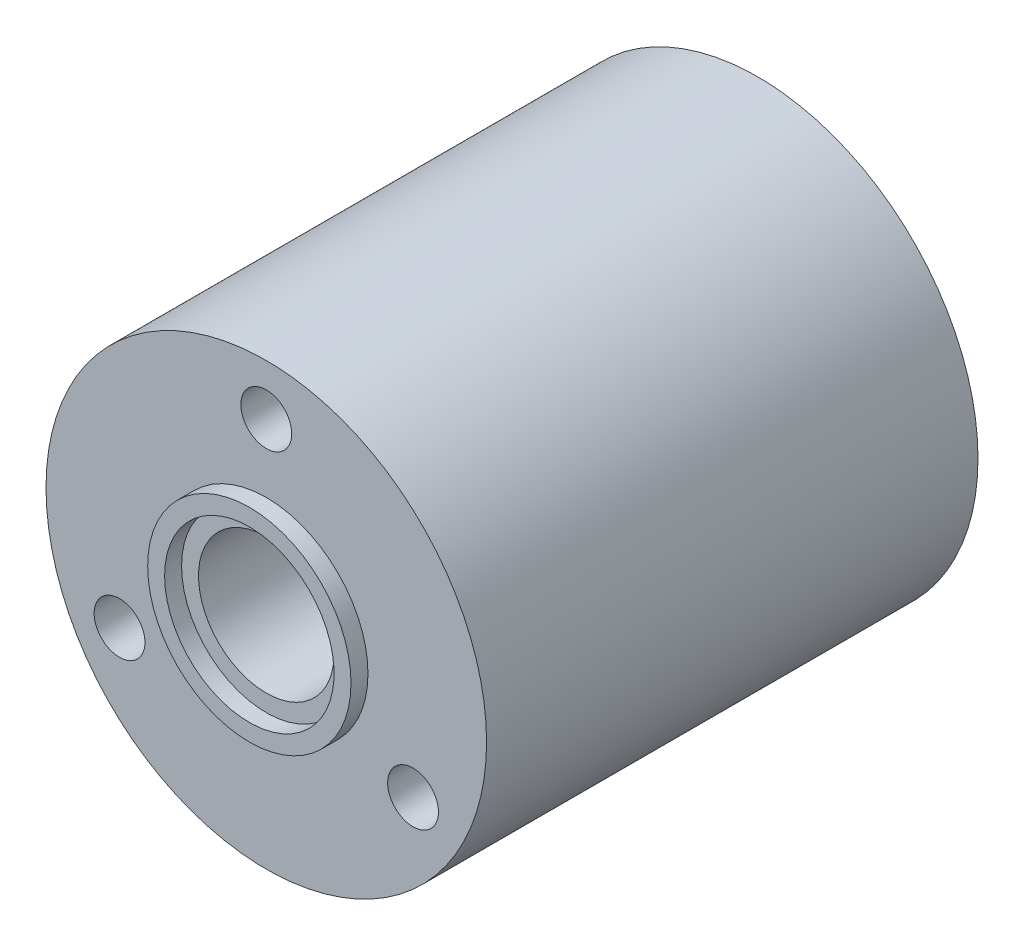
from build123d import *

# Parameters (mm, degrees)
SKETCH1_R           = 13
SKETCH1_R_2         = 5
BOSS_EXTRUDE1_DEPTH = 29
SKETCH2_R           = 6
SKETCH2_R_2         = 5
BOSS_EXTRUDE2_DEPTH = 1
SKETCH3_R           = 1.5
CUT_EXTRUDE1_DEPTH  = 36.185224172
SKETCH4_R           = 5
SKETCH4_R_2         = 4
BOSS_EXTRUDE3_DEPTH = 29


with BuildPart() as part:
    # Sketch1 → Boss-Extrude1 (new body)
    with BuildSketch(Plane.XY):
        with Locations(Location((0, 0, 0), (0, 0, 180))):
            Circle(SKETCH1_R)
        with Locations(Location((0, 0, 0), (0, 0, 180))):
            Circle(SKETCH1_R_2, mode=Mode.SUBTRACT)
    extrude(amount=BOSS_EXTRUDE1_DEPTH)

    # Sketch2 → Boss-Extrude2 (add)
    with BuildSketch(Plane.XY.offset(29)):
        Circle(SKETCH2_R)
        with Locations(Location((0, 0, 0), (0, 0, 180))):
            Circle(SKETCH2_R_2, mode=Mode.SUBTRACT)
    boss_extrude2 = extrude(amount=BOSS_EXTRUDE2_DEPTH)

    # Mirror1: Boss-Extrude2 across plane
    add(boss_extrude2.mirror(Plane.XY.offset(14.5)))

    # Sketch3 → Cut-Extrude1 (cut, through all)
    with BuildSketch(Plane.XY.offset(29)):
        with Locations((0, 10)):
            Circle(SKETCH3_R)
        with Locations((8.660254038, -5)):
            Circle(SKETCH3_R)
        with Locations((-8.660254038, -5)):
            Circle(SKETCH3_R)
    extrude(amount=-CUT_EXTRUDE1_DEPTH, mode=Mode.SUBTRACT)

    # Sketch4 → Boss-Extrude3 (add)
    with BuildSketch(Plane.XY.offset(29)):
        with Locations(Location((0, 0, 0), (0, 0, 180))):
            Circle(SKETCH4_R)
        Circle(SKETCH4_R_2, mode=Mode.SUBTRACT)
    extrude(amount=-BOSS_EXTRUDE3_DEPTH)


solid = part.part
